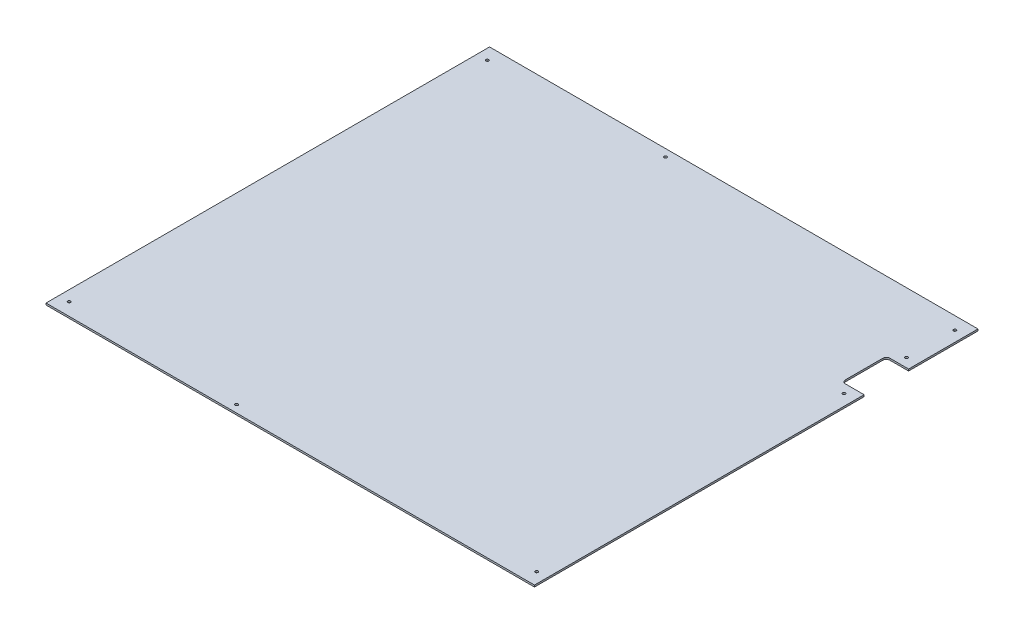
from build123d import *

# Parameters (mm, degrees)
CROQUIS1_W              = 550.5
CROQUIS1_H              = 500
SALIENTE_EXTRUIR1_DEPTH = 2
CROQUIS2_R              = 1.55
CORTAR_EXTRUIR1_DEPTH   = 2
CROQUIS3_W              = 550.5
CROQUIS3_H              = 500
CROQUIS3_W_2            = 549
CROQUIS3_H_2            = 498.5
CORTAR_EXTRUIR2_DEPTH   = 2
CROQUIS4_W              = 25
CROQUIS4_H              = 50
CORTAR_EXTRUIR3_DEPTH   = 2
REDONDEO1_R             = 4
CROQUIS5_R              = 1.6
CORTAR_EXTRUIR4_DEPTH   = 2
CROQUIS6_R              = 1.6
CORTAR_EXTRUIR5_DEPTH   = 2


with BuildPart() as part:
    # Croquis1 → Saliente-Extruir1 (new body)
    with BuildSketch(Plane(origin=(0, 0, 0), x_dir=(1, 0, 0), z_dir=(0, 1, 0))):
        with Locations((275.25, 250)):
            Rectangle(CROQUIS1_W, CROQUIS1_H)
    extrude(amount=SALIENTE_EXTRUIR1_DEPTH)

    # Croquis2 → Cortar-Extruir1 (cut)
    with BuildSketch(Plane(origin=(0, 2, 0), x_dir=(1, 0, 0), z_dir=(0, 1, 0))):
        with Locations(Location((12.5, 485, 0), (0, 0, 270))):
            Circle(CROQUIS2_R)
        with Locations(Location((538, 485, 0), (0, 0, 90))):
            Circle(CROQUIS2_R)
        with Locations(Location((538, 15, 0), (0, 0, 270))):
            Circle(CROQUIS2_R)
        with Locations(Location((12.5, 15, 0), (0, 0, 90))):
            Circle(CROQUIS2_R)
    extrude(amount=-CORTAR_EXTRUIR1_DEPTH, mode=Mode.SUBTRACT)

    # Croquis3 → Cortar-Extruir2 (cut)
    with BuildSketch(Plane(origin=(0, 2, 0), x_dir=(1, 0, 0), z_dir=(0, 1, 0))):
        with Locations((275.25, 250)):
            Rectangle(CROQUIS3_W, CROQUIS3_H)
        with Locations((275.25, 250)):
            Rectangle(CROQUIS3_W_2, CROQUIS3_H_2, mode=Mode.SUBTRACT)
    extrude(amount=-CORTAR_EXTRUIR2_DEPTH, mode=Mode.SUBTRACT)

    # Croquis4 → Cortar-Extruir3 (cut)
    with BuildSketch(Plane(origin=(0, 2, 0), x_dir=(1, 0, 0), z_dir=(0, 1, 0))):
        with Locations((537.25, 396.25)):
            Rectangle(CROQUIS4_W, CROQUIS4_H)
    extrude(amount=-CORTAR_EXTRUIR3_DEPTH, mode=Mode.SUBTRACT)

    # Redondeo1
    redondeo1_edges = [part.edges().sort_by_distance(p)[0] for p in [
        (524.75, 1, -421.25),
        (524.75, 1, -371.25),
    ]]
    fillet(redondeo1_edges, radius=REDONDEO1_R)

    # Croquis5 → Cortar-Extruir4 (cut)
    with BuildSketch(Plane(origin=(0, 2, 0), x_dir=(1, 0, 0), z_dir=(0, 1, 0))):
        with Locations(Location((537.25, 431.25, 0), (0, 0, 270))):
            Circle(CROQUIS5_R)
        with Locations(Location((537.25, 361.25, 0), (0, 0, 270))):
            Circle(CROQUIS5_R)
    extrude(amount=-CORTAR_EXTRUIR4_DEPTH, mode=Mode.SUBTRACT)

    # Croquis6 → Cortar-Extruir5 (cut)
    with BuildSketch(Plane(origin=(0, 2, 0), x_dir=(1, 0, 0), z_dir=(0, 1, 0))):
        with Locations(Location((206.75, 491, 0), (0, 0, 270))):
            Circle(CROQUIS6_R)
        with Locations(Location((206.75, 9, 0), (0, 0, 270))):
            Circle(CROQUIS6_R)
    extrude(amount=-CORTAR_EXTRUIR5_DEPTH, mode=Mode.SUBTRACT)


solid = part.part
